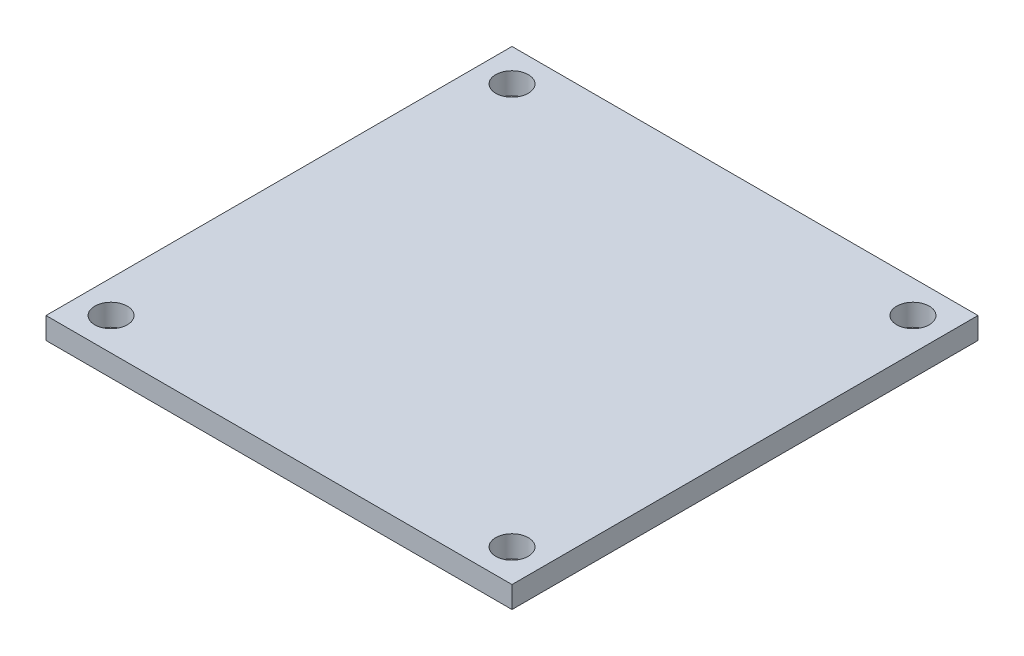
from build123d import *

# Parameters (mm, degrees)
SKETCH_2_W      = 43
SKETCH_2_H      = 43
SKETCH_2_R      = 1.5
EXTRUDE_1_DEPTH = 2


with BuildPart() as part:
    # 草图2 → 凸台-拉伸1 (new body)
    with BuildSketch(Plane(origin=(0, 0, 0), x_dir=(1, 0, 0), z_dir=(0, 1, 0))):
        Rectangle(SKETCH_2_W, SKETCH_2_H)
        with Locations(Location((-18.5, 18.5, 0), (0, 0, 270))):
            Circle(SKETCH_2_R, mode=Mode.SUBTRACT)
        with Locations(Location((-18.5, -18.5, 0), (0, 0, 270))):
            Circle(SKETCH_2_R, mode=Mode.SUBTRACT)
        with Locations(Location((18.5, 18.5, 0), (0, 0, 270))):
            Circle(SKETCH_2_R, mode=Mode.SUBTRACT)
        with Locations(Location((18.5, -18.5, 0), (0, 0, 270))):
            Circle(SKETCH_2_R, mode=Mode.SUBTRACT)
    extrude(amount=EXTRUDE_1_DEPTH)


solid = part.part
